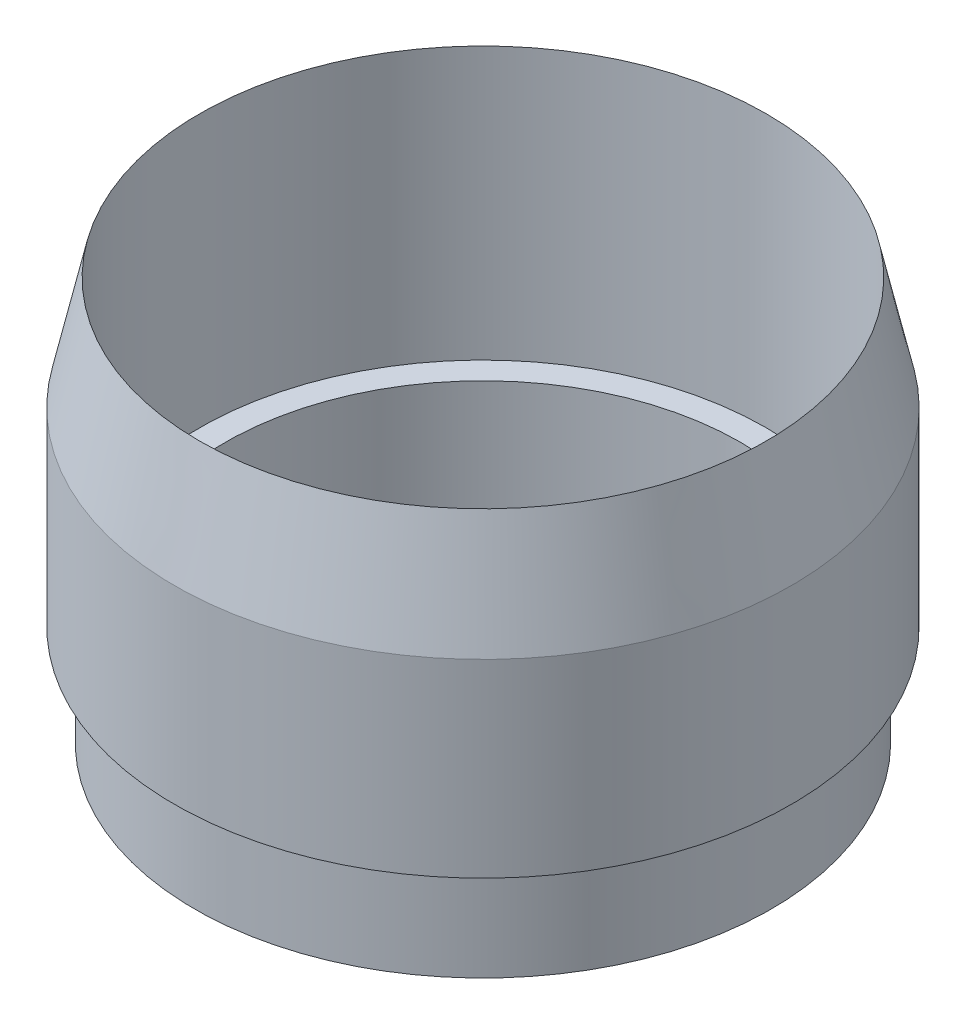
from build123d import *


with BuildPart() as part:
    # Sketch1 → Revolve1 (revolve)
    with BuildSketch(Plane.XY, mode=Mode.PRIVATE) as revolve1_sk:
        Polygon((-30.616, 13), (-30.616, 10), (-28.616, 10), (-28.616, 0), (-25.616, 0), (-25.616, 13), (-28.135, 13), (-28.135, 40), (-30.616, 28.808932202), align=None)
    revolve(revolve1_sk.sketch.rotate(Axis((0, 0, 0), (0, 1, 0)), 270), axis=Axis((0, 0, 0), (0, 1, 0)))


solid = part.part
